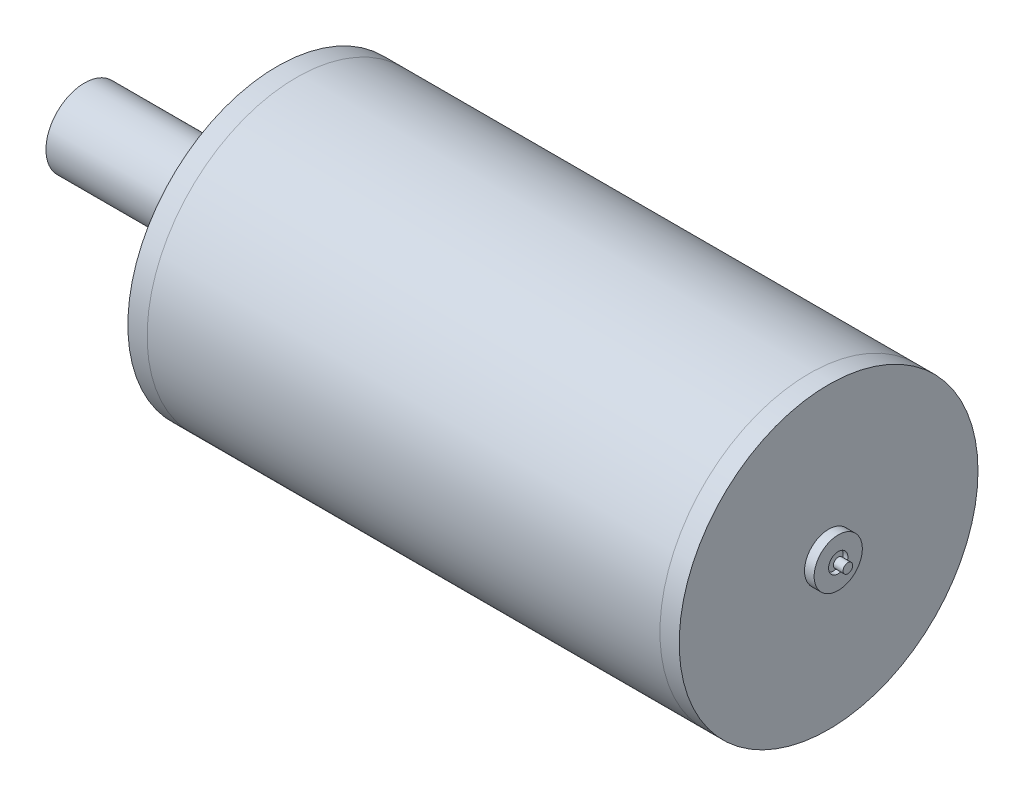
from build123d import *

# Parameters (mm, degrees)
CROQUIS2_R              = 15.5
SALIENTE_EXTRUIR1_DEPTH = 2
CROQUIS3_R              = 15.5
SALIENTE_EXTRUIR2_DEPTH = 53.2
CROQUIS4_R              = 15.5
SALIENTE_EXTRUIR3_DEPTH = 2
CROQUIS5_R              = 2.5
SALIENTE_EXTRUIR4_DEPTH = 1
CROQUIS6_R              = 0.5
SALIENTE_EXTRUIR5_DEPTH = 1
CROQUIS8_R              = 4
SALIENTE_EXTRUIR6_DEPTH = 20
CROQUIS9_R              = 1
CORTAR_EXTRUIR4_DEPTH   = 0.5


with BuildPart() as part:
    # Croquis2 → Saliente-Extruir1 (new body)
    with BuildSketch(Plane(origin=(0, 0, 0), x_dir=(0, 0, -1), z_dir=(1, 0, 0))):
        Circle(CROQUIS2_R)
    extrude(amount=SALIENTE_EXTRUIR1_DEPTH)

    # Croquis8 → Saliente-Extruir6 (add)
    with BuildSketch(Plane(origin=(0, 0, 0), x_dir=(0, 0, -1), z_dir=(1, 0, 0))):
        Circle(CROQUIS8_R)
    extrude(amount=-SALIENTE_EXTRUIR6_DEPTH)


with BuildPart() as body_2:
    # Croquis3 → Saliente-Extruir2 (new body)
    with BuildSketch(Plane(origin=(2, 0, 0), x_dir=(0, 0, -1), z_dir=(1, 0, 0))):
        Circle(CROQUIS3_R)
    extrude(amount=SALIENTE_EXTRUIR2_DEPTH)


with BuildPart() as body_3:
    # Croquis4 → Saliente-Extruir3 (new body)
    with BuildSketch(Plane(origin=(55.2, 0, 0), x_dir=(0, 0, -1), z_dir=(1, 0, 0))):
        Circle(CROQUIS4_R)
    extrude(amount=SALIENTE_EXTRUIR3_DEPTH)


with BuildPart() as body_4:
    # Croquis5 → Saliente-Extruir4 (new body)
    with BuildSketch(Plane(origin=(57.2, 0, 0), x_dir=(0, 0, -1), z_dir=(1, 0, 0))):
        Circle(CROQUIS5_R)
    extrude(amount=SALIENTE_EXTRUIR4_DEPTH)

    # Croquis9 → Cortar-Extruir4 (cut)
    with BuildSketch(Plane(origin=(58.2, 0, 0), x_dir=(0, 0, -1), z_dir=(1, 0, 0))):
        Circle(CROQUIS9_R)
    extrude(amount=-CORTAR_EXTRUIR4_DEPTH, mode=Mode.SUBTRACT)


with BuildPart() as body_5:
    # Croquis6 → Saliente-Extruir5 (new body)
    with BuildSketch(Plane(origin=(58.2, 0, 0), x_dir=(0, 0, -1), z_dir=(1, 0, 0))):
        Circle(CROQUIS6_R)
    extrude(amount=SALIENTE_EXTRUIR5_DEPTH)


solid = Compound([part.part, body_2.part, body_3.part, body_4.part, body_5.part])
